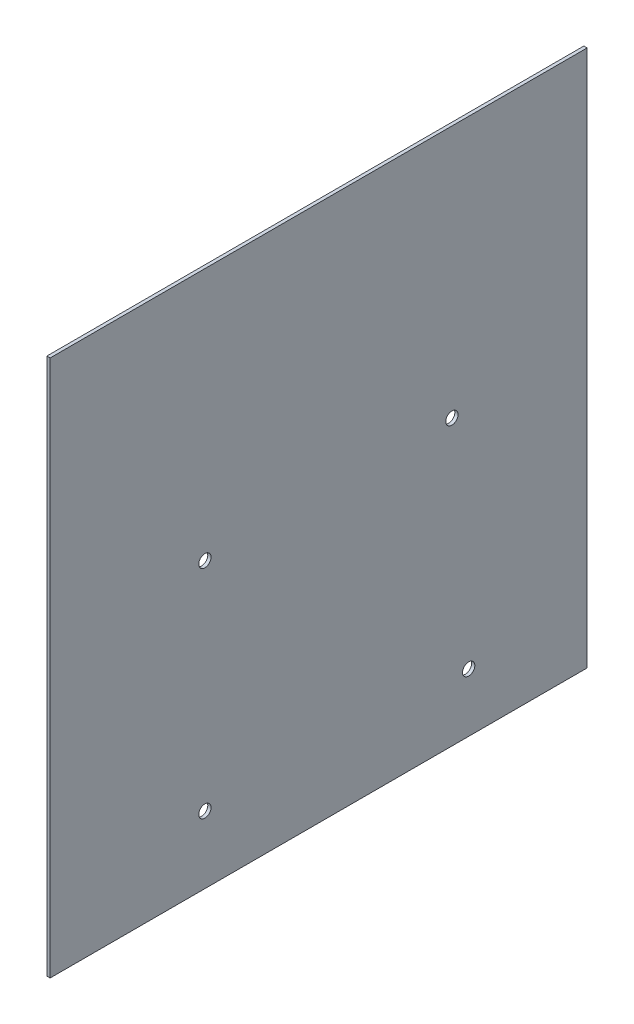
from build123d import *

# Parameters (mm, degrees)
SKETCH2_W           = 130.8
SKETCH2_H           = 130.8
BOSS_EXTRUDE1_DEPTH = 0.8
SKETCH3_R           = 1.5
CUT_EXTRUDE1_DEPTH  = 10


with BuildPart() as part:
    # Sketch2 → Boss-Extrude1 (new body)
    with BuildSketch(Plane(origin=(0, 0, 0), x_dir=(0, 0, -1), z_dir=(1, 0, 0))):
        Rectangle(SKETCH2_W, SKETCH2_H)
    extrude(amount=BOSS_EXTRUDE1_DEPTH)

    # Sketch3 → Cut-Extrude1 (cut)
    with BuildSketch(Plane(origin=(0, 0, 0), x_dir=(0, 0, -1), z_dir=(1, 0, 0))):
        with Locations((-27.704921719, 3.787782266)):
            Circle(SKETCH3_R)
        with Locations((32.466705139, 3.787782266)):
            Circle(SKETCH3_R)
        with Locations((-27.704921719, -49.02472476)):
            Circle(SKETCH3_R)
        with Locations((36.54627149, -51.189171769)):
            Circle(SKETCH3_R)
    extrude(amount=CUT_EXTRUDE1_DEPTH, mode=Mode.SUBTRACT)


solid = part.part
